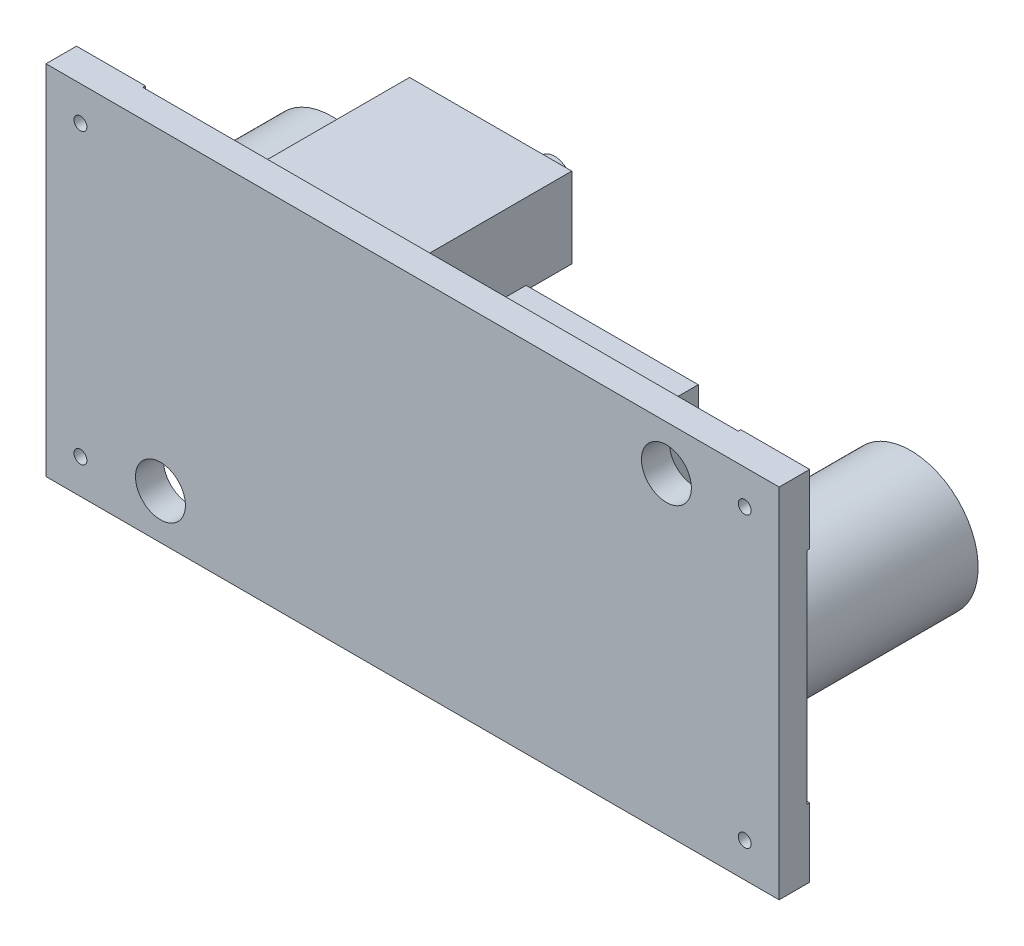
from build123d import *

# Parameters (mm, degrees)
SKETCH1_W           = 43.2816
SKETCH1_H           = 21.1074
BOSS_EXTRUDE1_DEPTH = 1.651
SKETCH2_R           = 1.4732
CUT_EXTRUDE1_DEPTH  = 49.18241416
SKETCH3_R           = 3.9878
BOSS_EXTRUDE2_DEPTH = 10.668
SKETCH4_W           = 10.16
SKETCH4_H           = 8.382
BOSS_EXTRUDE3_DEPTH = 3.7338
SKETCH4_3_W         = 11.684
SKETCH4_3_H         = 11.684
BOSS_EXTRUDE4_DEPTH = 7.62
SKETCH4_4_W         = 9.5758
SKETCH4_4_H         = 4.7498
BOSS_EXTRUDE5_DEPTH = 9.652
SKETCH5_R           = 1.016
BOSS_EXTRUDE6_DEPTH = 0.762
SKETCH6_W           = 4.064
SKETCH6_H           = 4.064
BOSS_EXTRUDE7_DEPTH = 0.1524
SKETCH7_R           = 0.381
CUT_EXTRUDE2_DEPTH  = 50.288914339


with BuildPart() as part:
    # Sketch1 → Boss-Extrude1 (new body)
    with BuildSketch(Plane.XY):
        with Locations((21.6408, 10.5537)):
            Rectangle(SKETCH1_W, SKETCH1_H)
    extrude(amount=BOSS_EXTRUDE1_DEPTH)

    # Sketch2 → Cut-Extrude1 (cut, through all)
    with BuildSketch(Plane.XY.offset(1.651)):
        with Locations((36.6268, 18.4658)):
            Circle(SKETCH2_R)
        with Locations((6.7564, 2.6416)):
            Circle(SKETCH2_R)
    extrude(amount=-CUT_EXTRUDE1_DEPTH, mode=Mode.SUBTRACT)

    # Sketch3 → Boss-Extrude2 (add)
    with BuildSketch(Plane(origin=(0, 0, 0), x_dir=(-1, 0, 0), z_dir=(0, 0, -1))):
        with Locations((-4.5593, 10.5537)):
            Circle(SKETCH3_R)
        with Locations((-38.7223, 10.5537)):
            Circle(SKETCH3_R)
    extrude(amount=BOSS_EXTRUDE2_DEPTH)

    # Sketch4 → Boss-Extrude3 (add)
    with BuildSketch(Plane(origin=(0, 0, 0), x_dir=(-1, 0, 0), z_dir=(0, 0, -1))):
        with Locations((-28.0416, 14.3764)):
            Rectangle(SKETCH4_W, SKETCH4_H)
    extrude(amount=BOSS_EXTRUDE3_DEPTH)

    # Sketch4<3> → Boss-Extrude4 (add)
    with BuildSketch(Plane(origin=(0, 0, 0), x_dir=(-1, 0, 0), z_dir=(0, 0, -1))):
        with Locations((-15.494, 7.112)):
            Rectangle(SKETCH4_3_W, SKETCH4_3_H)
    extrude(amount=BOSS_EXTRUDE4_DEPTH)

    # Sketch4<4> → Boss-Extrude5 (add)
    with BuildSketch(Plane(origin=(0, 0, 0), x_dir=(-1, 0, 0), z_dir=(0, 0, -1))):
        with Locations((-14.9479, 17.4625)):
            Rectangle(SKETCH4_4_W, SKETCH4_4_H)
    extrude(amount=BOSS_EXTRUDE5_DEPTH)

    # Sketch5 → Boss-Extrude6 (add)
    with BuildSketch(Plane(origin=(0, 0, -9.652), x_dir=(-1, 0, 0), z_dir=(0, 0, -1))):
        with Locations((-17.9578, 18.3134)):
            Circle(SKETCH5_R)
    extrude(amount=BOSS_EXTRUDE6_DEPTH)

    # Sketch6 → Boss-Extrude7 (add)
    with BuildSketch(Plane(origin=(0, 0, 0), x_dir=(-1, 0, 0), z_dir=(0, 0, -1))):
        with Locations((-41.2496, 19.0754)):
            Rectangle(SKETCH6_W, SKETCH6_H)
        with Locations((-41.2496, 2.032)):
            Rectangle(SKETCH6_W, SKETCH6_H)
        with Locations((-2.032, 19.0754)):
            Rectangle(SKETCH6_W, SKETCH6_H)
        with Locations((-2.032, 2.032)):
            Rectangle(SKETCH6_W, SKETCH6_H)
    extrude(amount=BOSS_EXTRUDE7_DEPTH)

    # Sketch7 → Cut-Extrude2 (cut, through all)
    with BuildSketch(Plane(origin=(0, 0, -0.1524), x_dir=(-1, 0, 0), z_dir=(0, 0, -1))):
        with Locations((-41.2496, 19.0754)):
            Circle(SKETCH7_R)
        with Locations((-2.032, 19.0754)):
            Circle(SKETCH7_R)
        with Locations((-2.032, 2.032)):
            Circle(SKETCH7_R)
        with Locations((-41.2496, 2.032)):
            Circle(SKETCH7_R)
    extrude(amount=-CUT_EXTRUDE2_DEPTH, mode=Mode.SUBTRACT)


solid = part.part
